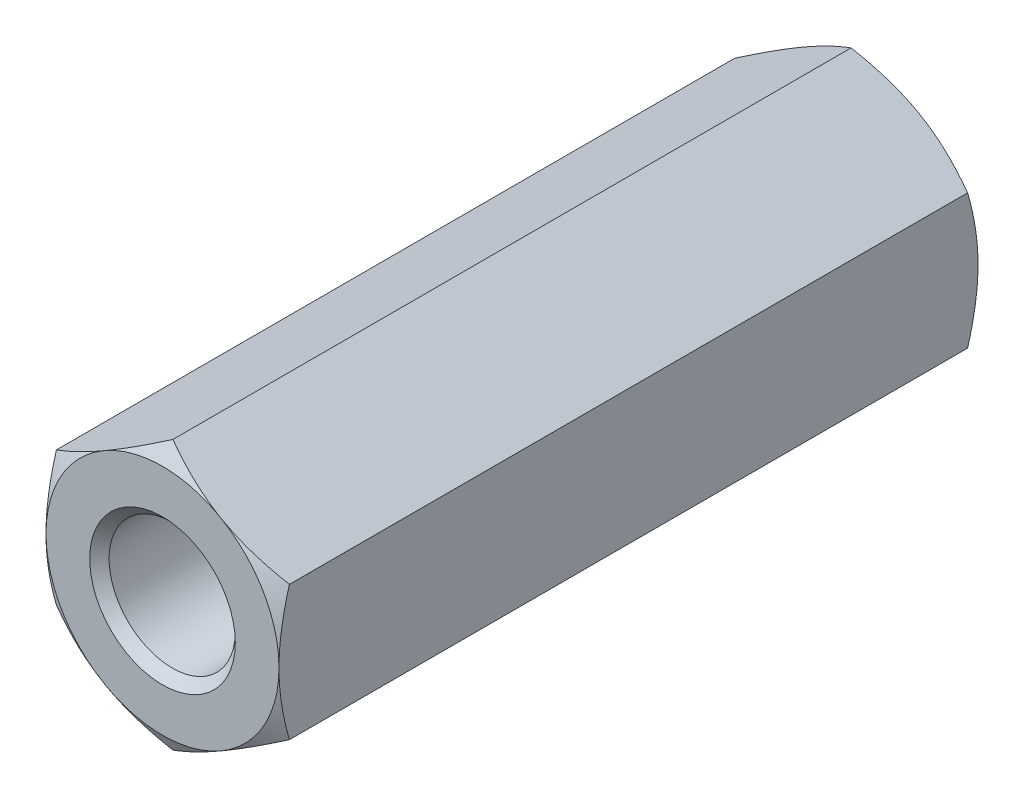
from build123d import *

# Parameters (mm, degrees)
BOSS_EXTRUDE1_DEPTH      = 9
BOSS_EXTRUDE1_DEPTH_BACK = 9
SKETCH1_R                = 1.625
SKETCH2_OUTSIDE_W        = 79.846
SKETCH2_OUTSIDE_H        = 80.774
SKETCH2_OUTSIDE_R        = 3
CUT_EXTRUDE1_DEPTH       = 19.574175621
CUT_EXTRUDE1_DRAFT       = -60
SKETCH3_OUTSIDE_W        = 79.846
SKETCH3_OUTSIDE_H        = 80.774
SKETCH3_OUTSIDE_R        = 3
CUT_EXTRUDE2_DEPTH       = 19.574175621
CUT_EXTRUDE2_DRAFT       = -60
CHAMFER1_SIZE            = 0.25


with BuildPart() as part:
    # Sketch1 → Boss-Extrude1 (new, two sides: drawn at the far end of the back side and taken through both)
    with BuildSketch(Plane.XY.offset(-BOSS_EXTRUDE1_DEPTH_BACK)):
        Polygon((0, 3.464101615), (-3, 1.732050808), (-3, -1.732050808), (0, -3.464101615), (3, -1.732050808), (3, 1.732050808), align=None)
        Circle(SKETCH1_R, mode=Mode.SUBTRACT)
    extrude(amount=BOSS_EXTRUDE1_DEPTH + BOSS_EXTRUDE1_DEPTH_BACK)


with BuildPart() as cut_extrude1_tool:
    # Sketch2 outside → Cut-Extrude1 (with draft: the straight prism first)
    with BuildSketch(Plane(origin=(0, 0, -9), x_dir=(-1, 0, 0), z_dir=(0, 0, -1))):
        Rectangle(SKETCH2_OUTSIDE_W, SKETCH2_OUTSIDE_H)
        Circle(SKETCH2_OUTSIDE_R, mode=Mode.SUBTRACT)
    extrude(amount=-CUT_EXTRUDE1_DEPTH)
    # Cut-Extrude1: the draft: its side faces are tilted about the plane it starts from
    cut_extrude1_sides = [cut_extrude1_tool.faces().sort_by_distance(p)[0] for p in [
        (0, -40.387, 0.787087811),
        (-39.923, 0, 0.787087811),
        (0, 40.387, 0.787087811),
        (39.923, 0, 0.787087811),
        (3, 0, 0.787087811),
    ]]
    draft(cut_extrude1_sides, Plane(origin=(0, 0, -9), x_dir=(-1, 0, 0), z_dir=(0, 0, -1)), CUT_EXTRUDE1_DRAFT)


with BuildPart() as part_1:
    add(part.part)

    # Cut-Extrude1: cut by cut_extrude1_tool
    add(cut_extrude1_tool.part, mode=Mode.SUBTRACT)


with BuildPart() as cut_extrude2_tool:
    # Sketch3 outside → Cut-Extrude2 (with draft: the straight prism first)
    with BuildSketch(Plane.XY.offset(9)):
        Rectangle(SKETCH3_OUTSIDE_W, SKETCH3_OUTSIDE_H)
        Circle(SKETCH3_OUTSIDE_R, mode=Mode.SUBTRACT)
    extrude(amount=-CUT_EXTRUDE2_DEPTH)
    # Cut-Extrude2: the draft: its side faces are tilted about the plane it starts from
    cut_extrude2_sides = [cut_extrude2_tool.faces().sort_by_distance(p)[0] for p in [
        (0, -40.387, -0.787087811),
        (39.923, 0, -0.787087811),
        (0, 40.387, -0.787087811),
        (-39.923, 0, -0.787087811),
        (-3, 0, -0.787087811),
    ]]
    draft(cut_extrude2_sides, Plane.XY.offset(9), CUT_EXTRUDE2_DRAFT)


with BuildPart() as part_2:
    add(part_1.part)

    # Cut-Extrude2: cut by cut_extrude2_tool
    add(cut_extrude2_tool.part, mode=Mode.SUBTRACT)

    # Chamfer1
    chamfer1_edges = [part_2.edges().sort_by_distance(p)[0] for p in [
        (-1.625, 0, -9),
        (-1.625, 0, 9),
    ]]
    chamfer(chamfer1_edges, length=CHAMFER1_SIZE)


solid = part_2.part
